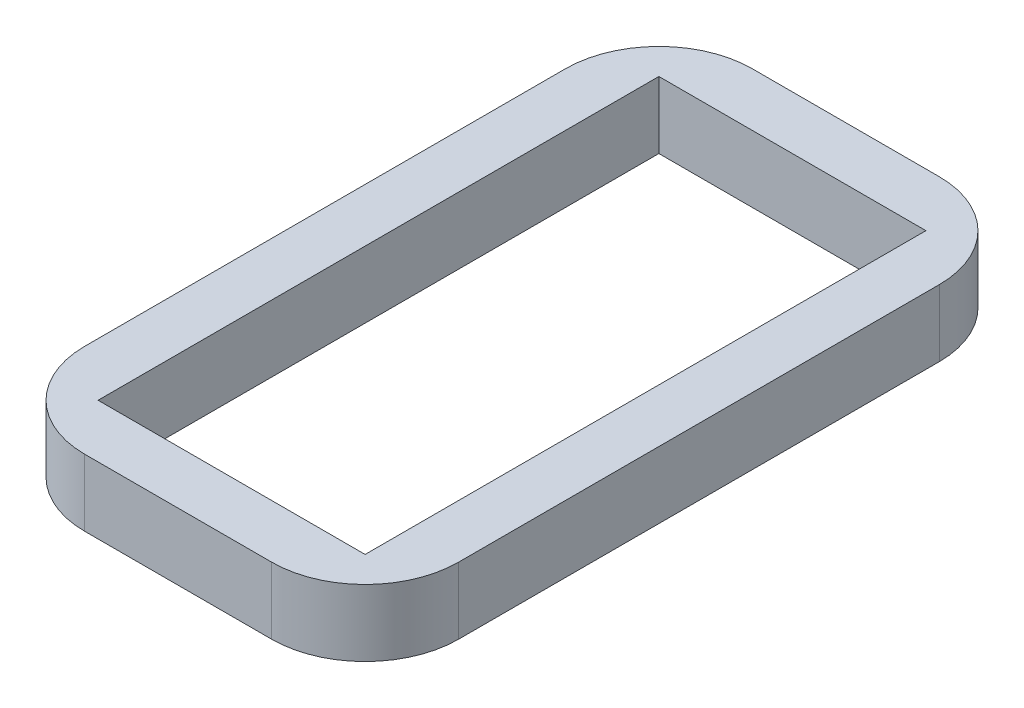
from build123d import *

# Parameters (mm, degrees)
ESQUISSE1_W        = 28
ESQUISSE1_H        = 50
ESQUISSE1_W_2      = 20
ESQUISSE1_H_2      = 42
BOSS_EXTRU_1_DEPTH = 5
CONG_1_R           = 7


with BuildPart() as part:
    # Esquisse1 → Boss.-Extru.1 (new body)
    with BuildSketch(Plane(origin=(0, 0, 0), x_dir=(1, 0, 0), z_dir=(0, 1, 0))):
        Rectangle(ESQUISSE1_W, ESQUISSE1_H)
        Rectangle(ESQUISSE1_W_2, ESQUISSE1_H_2, mode=Mode.SUBTRACT)
    extrude(amount=BOSS_EXTRU_1_DEPTH)

    # Congé1
    cong_1_edges = [part.edges().sort_by_distance(p)[0] for p in [
        (14, 2.5, 25),
        (-14, 2.5, 25),
        (-14, 2.5, -25),
        (14, 2.5, -25),
    ]]
    fillet(cong_1_edges, radius=CONG_1_R)


solid = part.part
